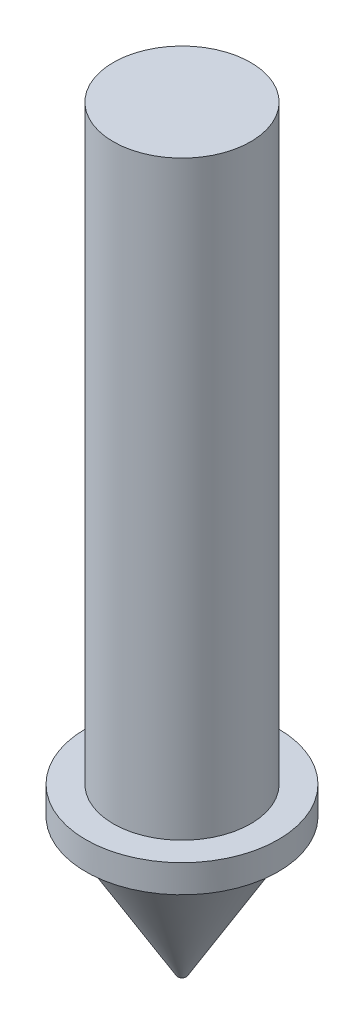
from build123d import *

# Parameters (mm, degrees)
SKETCH_1_R          = 7
EXTRUDE_1_DEPTH     = 55
CUT_EXTRUDE_START   = -43
SKETCH_2_R          = 7
SKETCH_2_R_2        = 5
CUT_EXTRUDE_2_DEPTH = 43


with BuildPart() as part:
    # 草图1 → 凸台-拉伸1 (new body)
    with BuildSketch(Plane(origin=(0, 0, 0), x_dir=(1, 0, 0), z_dir=(0, 1, 0))):
        with Locations(Location((0, 0, 0), (0, 0, 270))):
            Circle(SKETCH_1_R)
    extrude(amount=EXTRUDE_1_DEPTH)

    # 草图2 → 切除-拉伸2 (cut)
    with BuildSketch(Plane(origin=(0, 55, 0), x_dir=(1, 0, 0), z_dir=(0, 1, 0)).offset(CUT_EXTRUDE_START)):
        with Locations(Location((0, 0, 0), (0, 0, 270))):
            Circle(SKETCH_2_R)
        with Locations(Location((0, 0, 0), (0, 0, 270))):
            Circle(SKETCH_2_R_2, mode=Mode.SUBTRACT)
    extrude(amount=CUT_EXTRUDE_2_DEPTH, mode=Mode.SUBTRACT)

    # 草图8 → 切除-旋转25 (revolve, cut)
    with BuildSketch(Plane.XY, mode=Mode.PRIVATE) as cut_revolve_25_sk:
        Polygon((-7, 9.974534831), (-6.231936672, 9.974534831), (-0.307906931, 0), (-7, 0), align=None)
    revolve(cut_revolve_25_sk.sketch.rotate(Axis((0, 0, 0), (0, 1, 0)), 270), axis=Axis((0, 0, 0), (0, 1, 0)), mode=Mode.SUBTRACT)


solid = part.part
